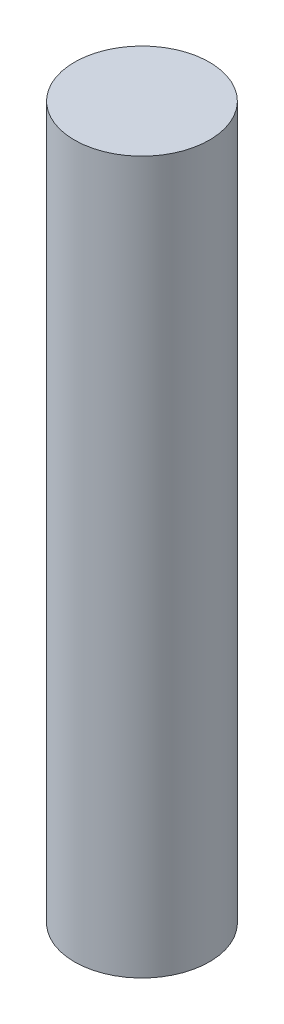
from build123d import *

# Parameters (mm, degrees)
SKETCH1_R           = 275
BOSS_EXTRUDE1_DEPTH = 2900


with BuildPart() as part:
    # Sketch1 → Boss-Extrude1 (new body)
    with BuildSketch(Plane(origin=(0, 0, 0), x_dir=(1, 0, 0), z_dir=(0, 1, 0))):
        with Locations(Location((0, 0, 0), (0, 0, 270))):
            Circle(SKETCH1_R)
    extrude(amount=BOSS_EXTRUDE1_DEPTH)


solid = part.part
